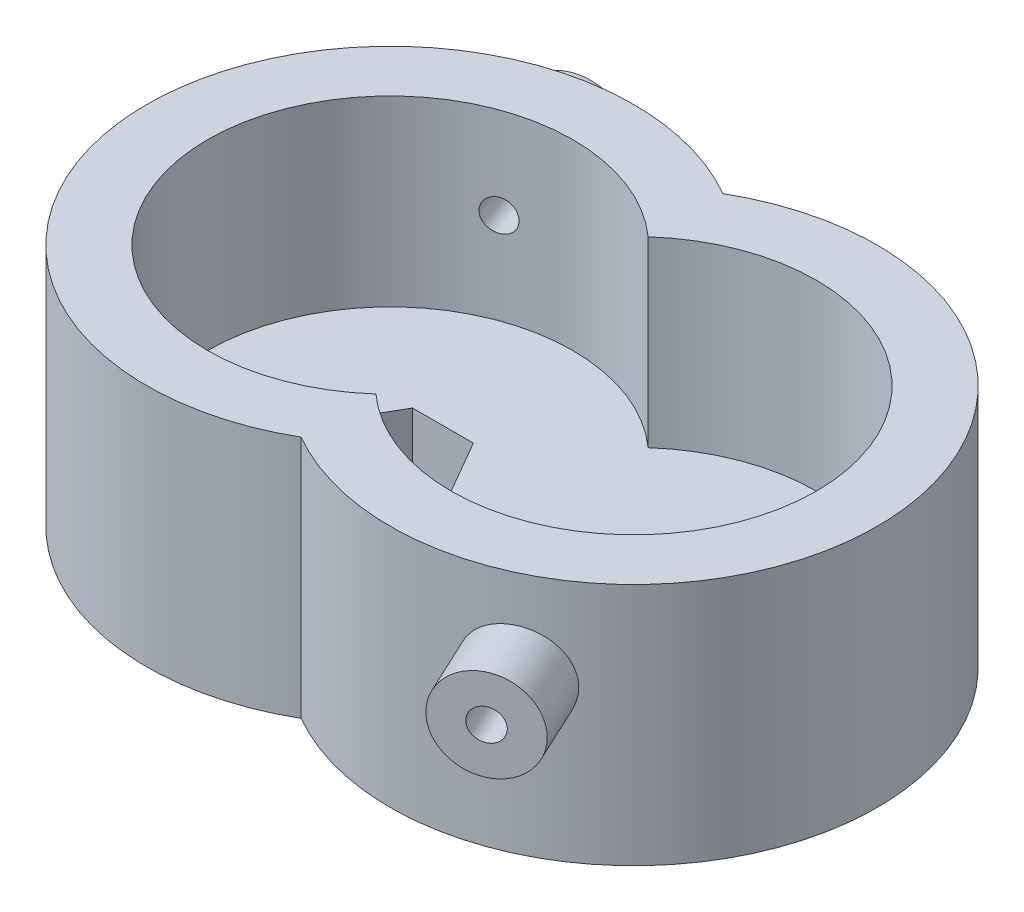
from build123d import *

# Parameters (mm, degrees)
BOSS_EXTRUDE1_DEPTH           = 50.8
CUT_EXTRUDE1_DEPTH            = 38.1
CUT_EXTRUDE2_DEPTH            = 38.1
BOSS_EXTRUDE3_DEPTH           = 12.7
BOSS_EXTRUDE3_DEPTH_BACK      = 12.7
SKETCH16_R                    = 9.525
F_5_16_18_TAPPED_HOLE4_REACH  = 170.58
F_5_16_18_TAPPED_HOLE4_BORE_R = 3.2639
BOSS_EXTRUDE6_DEPTH           = 12.7
BOSS_EXTRUDE6_DEPTH_BACK      = 5.08
SKETCH20_R                    = 9.525
F_5_16_18_TAPPED_HOLE5_REACH  = 180.939
F_5_16_18_TAPPED_HOLE5_BORE_R = 3.2639


with BuildPart() as part:
    # Sketch1 → Boss-Extrude1 (new body)
    with BuildSketch(Plane(origin=(0, 0, 0), x_dir=(1, 0, 0), z_dir=(0, 1, 0))):
        with BuildLine():
            ThreePointArc((25.4, 43.994090512), (-50.8, 0), (25.4, -43.994090512))
            ThreePointArc((25.4, -43.994090512), (101.6, 0), (25.4, 43.994090512))
        make_face()
    extrude(amount=BOSS_EXTRUDE1_DEPTH)

    # Sketch3 → Cut-Extrude1 (cut)
    with BuildSketch(Plane(origin=(0, 50.8, 0), x_dir=(1, 0, 0), z_dir=(0, 1, 0))):
        with BuildLine():
            ThreePointArc((25.4, -28.398063314), (88.9, 0), (25.4, 28.398063314))
            ThreePointArc((25.4, 28.398063314), (-38.1, 0), (25.4, -28.398063314))
        make_face()
    extrude(amount=-CUT_EXTRUDE1_DEPTH, mode=Mode.SUBTRACT)

    # Sketch5 → Cut-Extrude2 (cut)
    with BuildSketch(Plane(origin=(0, 12.7, 0), x_dir=(1, 0, 0), z_dir=(0, 1, 0))):
        Polygon((63.5, 0), (57.15, 10.998522628), (44.45, 10.998522628), (38.1, 0), (44.45, -10.998522628), (57.15, -10.998522628), align=None)
        Polygon((12.7, 0), (6.35, 10.998522628), (-6.35, 10.998522628), (-12.7, 0), (-6.35, -10.998522628), (6.35, -10.998522628), align=None)
    extrude(amount=-CUT_EXTRUDE2_DEPTH, mode=Mode.SUBTRACT)

    # Sketch16 → Boss-Extrude3 (add, two sides: drawn at the far end of the back side and taken through both)
    with BuildSketch(Plane(origin=(-17.374623281, 0, -47.736385136), x_dir=(0, -1, 0), z_dir=(-0.34202014332566666, 0, -0.9396926207859091)).offset(-BOSS_EXTRUDE3_DEPTH_BACK)):
        with Locations(Location((-31.75, 0, 0), (0, 0, 270))):
            Circle(SKETCH16_R)
    extrude(amount=BOSS_EXTRUDE3_DEPTH + BOSS_EXTRUDE3_DEPTH_BACK)

    # 5/16-18 Tapped Hole4 bore (on position points) → 5/16-18 Tapped Hole4 (cut, up to next)
    with BuildSketch(Plane(origin=(-21.718279101, 31.75, -59.67048142), x_dir=(-0.939692620786, 0, 0.342020143326), z_dir=(-0.342020143326, 0, -0.939692620786)), mode=Mode.PRIVATE) as f_5_16_18_tapped_hole4_sk1:
        Circle(F_5_16_18_TAPPED_HOLE4_BORE_R)
    f_5_16_18_tapped_hole4_tool1 = extrude(f_5_16_18_tapped_hole4_sk1.sketch, amount=-F_5_16_18_TAPPED_HOLE4_REACH, mode=Mode.PRIVATE) & part.part
    add(f_5_16_18_tapped_hole4_tool1.solids().sort_by_distance((-21.718279, 31.75, -59.670481))[0], mode=Mode.SUBTRACT)

    # Sketch20 → Boss-Extrude6 (add, two sides: drawn at the far end of the back side and taken through both)
    with BuildSketch(Plane(origin=(30.54220241, 0, 65.497964437), x_dir=(0, -1, 0), z_dir=(0.42261826174068773, 0, 0.9063077870366555)).offset(-BOSS_EXTRUDE6_DEPTH_BACK)):
        with Locations(Location((-31.75, 46.040435581, 0), (0, 0, 90))):
            Circle(SKETCH20_R)
    extrude(amount=BOSS_EXTRUDE6_DEPTH + BOSS_EXTRUDE6_DEPTH_BACK)

    # 5/16-18 Tapped Hole5 bore (on position points) → 5/16-18 Tapped Hole5 (cut, up to next)
    with BuildSketch(Plane(origin=(77.636259621, 31.75, 57.550544477), x_dir=(0.906307787037, 0, -0.422618261741), z_dir=(0.422618261741, 0, 0.906307787037)), mode=Mode.PRIVATE) as f_5_16_18_tapped_hole5_sk1:
        Circle(F_5_16_18_TAPPED_HOLE5_BORE_R)
    f_5_16_18_tapped_hole5_tool1 = extrude(f_5_16_18_tapped_hole5_sk1.sketch, amount=-F_5_16_18_TAPPED_HOLE5_REACH, mode=Mode.PRIVATE) & part.part
    add(f_5_16_18_tapped_hole5_tool1.solids().sort_by_distance((77.63626, 31.75, 57.550544))[0], mode=Mode.SUBTRACT)


solid = part.part
